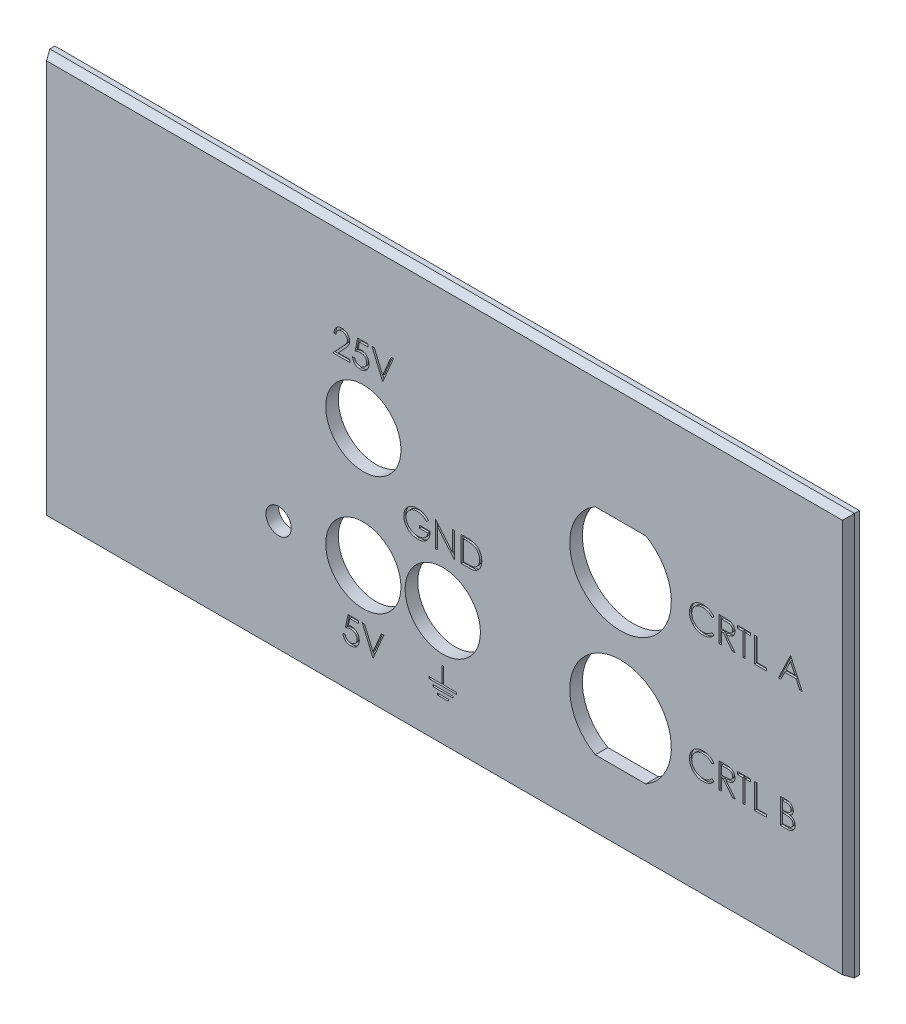
from build123d import *

# Parameters (mm, degrees)
SKETCH3_W               = 101.6
SKETCH3_H               = 50.8
BOSS_EXTRUDE1_DEPTH     = 0.635
SKETCH4_W               = 101.6
SKETCH4_H               = 50.8
BOSS_EXTRUDE2_DEPTH     = 0.9525
BOSS_EXTRUDE2_TAPER     = 30
CUT_EXTRUDE1_DEPTH      = 57.818308284
CUT_EXTRUDE1_DEPTH_BACK = 57.818308284
SKETCH5_R               = 4.750000025
M3_CLEARANCE_HOLE1_D    = 3.2
CUT_EXTRUDE2_DEPTH      = 57.818308284
CUT_EXTRUDE2_DEPTH_BACK = 0.254
SKETCH9_W               = 1.359861342
SKETCH9_H               = 0.220518055
SKETCH9_W_2             = 2.545442286
SKETCH9_H_2             = 0.219332475


with BuildPart() as part:
    # Sketch3 → Boss-Extrude1 (new body)
    with BuildSketch(Plane.XY.offset(-0.79375)):
        Rectangle(SKETCH3_W, SKETCH3_H)
    extrude(amount=BOSS_EXTRUDE1_DEPTH)

    # Sketch4 → Boss-Extrude2 (add)
    with BuildSketch(Plane.XY.offset(-0.15875)):
        Rectangle(SKETCH4_W, SKETCH4_H)
    extrude(amount=BOSS_EXTRUDE2_DEPTH, taper=BOSS_EXTRUDE2_TAPER)

    # Sketch5 → Cut-Extrude1 (cut, two sides: drawn at the far end of the back side and taken through both)
    with BuildSketch(Plane.XY.offset(0.79375).offset(-CUT_EXTRUDE1_DEPTH_BACK)):
        with Locations((-10.254, 4.6686)):
            Circle(SKETCH5_R)
        with Locations((-10.254, -10.3314)):
            Circle(SKETCH5_R)
        with Locations((-0.2214, -10.2764)):
            Circle(SKETCH5_R)
        with BuildLine():
            Line((19.032749463, 10.72709), (25.417250537, 10.72709))
            ThreePointArc((25.417250537, 10.72709), (22.225, -1.24901), (19.032749463, 10.72709))
        make_face()
        with BuildLine():
            Line((25.417250537, -16.39757), (19.032749463, -16.39757))
            ThreePointArc((19.032749463, -16.39757), (22.225, -4.42147), (25.417250537, -16.39757))
        make_face()
    extrude(amount=CUT_EXTRUDE1_DEPTH + CUT_EXTRUDE1_DEPTH_BACK, mode=Mode.SUBTRACT)

    # M3 Clearance Hole1 (through all)
    with Locations(Plane.XY.offset(0.79375)):
        with Locations((-20.955, -10.8314)):
            Hole(M3_CLEARANCE_HOLE1_D / 2)

    # Sketch9 → Cut-Extrude2 (cut, two sides: drawn at the far end of the back side and taken through both)
    # profile 1 of 21: a face of its own
    with BuildSketch(Plane.XY.offset(0.79375).offset(-CUT_EXTRUDE2_DEPTH_BACK)):
        with BuildLine():
            Line((34.021410066, -9.830062147), (33.772091156, -10.020867436))
            add(Edge.make_bspline(
                [(33.772091156, -10.020867436), (33.754305814, -9.999671163), (33.718974916, -9.95756439), (33.662134068, -9.898437232), (33.602896149, -9.843042316), (33.541283804, -9.791115754), (33.476188031, -9.744473402), (33.409185735, -9.700684616), (33.33915608, -9.661434596), (33.242317006, -9.613843173), (33.115636458, -9.56418059), (32.956165425, -9.522539801), (32.789694643, -9.49603202), (32.676122535, -9.493161057), (32.618355178, -9.491700769)],
                knots=[0, 0, 0, 0, 0.757959112, 1.505699292, 2.245454638, 2.979532153, 3.711538275, 4.438200793, 5.171680507, 5.909471876, 7.393775596, 8.890124382, 10.418191784, 12, 12, 12, 12], degree=3))
            add(Edge.make_bspline(
                [(32.618355178, -9.491700769), (32.586529614, -9.492067221), (32.523173856, -9.492796723), (32.429149884, -9.502420715), (32.336881616, -9.515947313), (32.246429072, -9.536018142), (32.157907388, -9.561393304), (32.070737852, -9.591714929), (31.986182522, -9.629229677), (31.903071692, -9.670693598), (31.823443407, -9.717527066), (31.748100614, -9.768611321), (31.6773181, -9.823374716), (31.611039874, -9.882022505), (31.549198178, -9.944290569), (31.492241117, -10.010842508), (31.440365781, -10.081465551), (31.392543908, -10.155228427), (31.349715214, -10.231916281), (31.313855966, -10.311812952), (31.28210132, -10.393550246), (31.25697415, -10.478051656), (31.237085481, -10.564722594), (31.223362529, -10.653795666), (31.213847987, -10.745084789), (31.213122113, -10.80696038), (31.21275622, -10.838150088)],
                knots=[0, 0, 0, 0, 1.054917814, 2.100044995, 3.131103042, 4.146048494, 5.169673617, 6.183595914, 7.203665975, 8.234915748, 9.262203917, 10.264457458, 11.251630812, 12.227803204, 13.197192746, 14.159520551, 15.12972552, 16.100847026, 17.073214652, 18.039054194, 19.002613845, 19.979014051, 20.95965708, 21.949030935, 22.966165397, 24, 24, 24, 24], degree=3))
            add(Edge.make_bspline(
                [(31.21275622, -10.838150088), (31.21390087, -10.885077785), (31.216148239, -10.977214095), (31.236149228, -11.112170291), (31.266543132, -11.241456903), (31.312095834, -11.364265759), (31.368265258, -11.482111199), (31.43924067, -11.592999301), (31.521442815, -11.698605756), (31.616034609, -11.796434716), (31.719817028, -11.885800738), (31.831166919, -11.964495909), (31.949806952, -12.030095838), (32.074427181, -12.084684018), (32.205986584, -12.126645478), (32.344248583, -12.15618579), (32.488912465, -12.175455482), (32.587763278, -12.177300328), (32.638071725, -12.178239231)],
                knots=[0, 0, 0, 0, 1.029171465, 2.020641659, 2.987623507, 3.938342917, 4.889210282, 5.84687017, 6.821220943, 7.821438502, 8.827599549, 9.822697543, 10.807740252, 11.797342354, 12.80366471, 13.83203677, 14.896651826, 16, 16, 16, 16], degree=3))
            add(Edge.make_bspline(
                [(32.638071725, -12.178239231), (32.693500593, -12.176707266), (32.802597864, -12.173691994), (32.96258886, -12.148147532), (33.115747018, -12.106729278), (33.262080579, -12.048764734), (33.401177008, -11.973412652), (33.533253979, -11.882065291), (33.658422975, -11.773853732), (33.733689781, -11.691228323), (33.772091156, -11.649072564)],
                knots=[0, 0, 0, 0, 1.028121516, 2.023589091, 2.998037872, 3.967518031, 4.937445131, 5.927275754, 6.942489185, 8, 8, 8, 8], degree=3))
            Line((33.772091156, -11.649072564), (34.021410066, -11.8379698))
            add(Edge.make_bspline(
                [(34.021410066, -11.8379698), (34.001345781, -11.863858252), (33.961313317, -11.915511154), (33.896490687, -11.988329062), (33.828203424, -12.056822008), (33.755944316, -12.120437779), (33.680544605, -12.18044933), (33.600650436, -12.235151706), (33.517312099, -12.285308436), (33.430811965, -12.331234289), (33.341241938, -12.371980649), (33.248709343, -12.40686371), (33.153613035, -12.436912717), (33.055948667, -12.461634117), (32.955513659, -12.480930028), (32.852670443, -12.493829305), (32.747197056, -12.502666613), (32.676039482, -12.503472079), (32.639979778, -12.503880256)],
                knots=[0, 0, 0, 0, 0.986787822, 1.968848986, 2.935600012, 3.899624008, 4.868462664, 5.837806735, 6.815139263, 7.798259679, 8.787526145, 9.778297419, 10.776456485, 11.791383307, 12.812564526, 13.85620153, 14.913611965, 16, 16, 16, 16], degree=3))
            add(Edge.make_bspline(
                [(32.639979778, -12.503880256), (32.605831594, -12.503642592), (32.538307789, -12.503172639), (32.438613922, -12.495559745), (32.341559088, -12.485173197), (32.247420677, -12.469533936), (32.155684971, -12.451078713), (32.067183584, -12.426339787), (31.981045643, -12.398627329), (31.89761722, -12.366056377), (31.816827349, -12.329302411), (31.738936606, -12.287762926), (31.663980814, -12.241787234), (31.591223039, -12.19238876), (31.521738088, -12.137980779), (31.454923819, -12.079318904), (31.390405573, -12.016600851), (31.350488851, -11.971375377), (31.330419481, -11.948636867)],
                knots=[0, 0, 0, 0, 1.114604814, 2.203992996, 3.262667896, 4.300477797, 5.318619304, 6.316056647, 7.298880507, 8.271930387, 9.238335007, 10.195173496, 11.151986948, 12.108099108, 13.064862484, 14.031167946, 15.010108607, 16, 16, 16, 16], degree=3))
            add(Edge.make_bspline(
                [(31.330419481, -11.948636867), (31.29827429, -11.909138788), (31.234371993, -11.830619487), (31.152615123, -11.703360061), (31.08263127, -11.570492472), (31.026047399, -11.431318679), (30.981812634, -11.286150978), (30.951168264, -11.13491619), (30.931255023, -10.977755556), (30.928977832, -10.870860755), (30.927820323, -10.816525489)],
                knots=[0, 0, 0, 0, 0.994628077, 1.977248131, 2.950237994, 3.925870899, 4.908910175, 5.911660606, 6.938484602, 8, 8, 8, 8], degree=3))
            add(Edge.make_bspline(
                [(30.927820323, -10.816525489), (30.929231105, -10.759415899), (30.932006732, -10.647056346), (30.955588632, -10.482161402), (30.993524255, -10.324181205), (31.047405718, -10.173410665), (31.115718429, -10.029056768), (31.200106858, -9.892222247), (31.299590622, -9.762032007), (31.413389487, -9.640461482), (31.538182713, -9.529300784), (31.671821923, -9.431505156), (31.814045546, -9.350118553), (31.96328674, -9.28208632), (32.120663037, -9.229794557), (32.285838665, -9.193188451), (32.458503252, -9.170403639), (32.576307023, -9.167523272), (32.636163672, -9.166059744)],
                knots=[0, 0, 0, 0, 1.032925535, 2.032216505, 3.007276963, 3.968222605, 4.92396291, 5.891752235, 6.871517503, 7.883894988, 8.900124299, 9.891468569, 10.874487609, 11.85992873, 12.854644235, 13.869047385, 14.917252991, 16, 16, 16, 16], degree=3))
            add(Edge.make_bspline(
                [(32.636163672, -9.166059744), (32.672643943, -9.166497112), (32.744852965, -9.167362838), (32.851671443, -9.175804838), (32.955668411, -9.189877896), (33.056915516, -9.209033187), (33.155905318, -9.232806972), (33.251881251, -9.2637771), (33.345406488, -9.29918881), (33.435891183, -9.339972561), (33.522901197, -9.385753105), (33.606409429, -9.436022993), (33.68575255, -9.490719902), (33.761488863, -9.54937864), (33.832351426, -9.61324019), (33.900352196, -9.680548009), (33.963181888, -9.753240835), (34.001965143, -9.804408168), (34.021410066, -9.830062147)],
                knots=[0, 0, 0, 0, 1.096760587, 2.17092713, 3.219439832, 4.250915756, 5.268269357, 6.278326846, 7.281116186, 8.274029601, 9.260640565, 10.235837813, 11.203064059, 12.156899882, 13.114053108, 14.069676657, 15.032185724, 16, 16, 16, 16], degree=3))
        make_face()
    # profile 2 of 21: a face of its own
    with BuildSketch(Plane.XY.offset(0.79375).offset(-CUT_EXTRUDE2_DEPTH_BACK)):
        with BuildLine():
            Line((34.672692117, -9.24747), (35.308073728, -9.24747))
            add(Edge.make_bspline(
                [(35.308073728, -9.24747), (35.350474609, -9.247611139), (35.431888997, -9.247882141), (35.548523321, -9.249393226), (35.654502187, -9.253724248), (35.749770184, -9.25745132), (35.834325564, -9.264247582), (35.908427607, -9.270743311), (35.971735018, -9.279246561), (36.01005804, -9.287143623), (36.027409666, -9.290719199)],
                knots=[0, 0, 0, 0, 1.410062039, 2.707475311, 3.878576406, 4.937260626, 5.877586885, 6.699081471, 7.410979367, 8, 8, 8, 8], degree=3))
            add(Edge.make_bspline(
                [(36.027409666, -9.290719199), (36.050638532, -9.296458479), (36.096600729, -9.307814604), (36.162776861, -9.331817242), (36.225836283, -9.359593616), (36.285517052, -9.392217848), (36.341520234, -9.429932112), (36.394423273, -9.472085338), (36.444466229, -9.518446874), (36.48962528, -9.570185623), (36.532205705, -9.624465886), (36.568118245, -9.683161437), (36.599075837, -9.744540108), (36.623723378, -9.809226123), (36.643569825, -9.876592159), (36.657563628, -9.947248424), (36.665955777, -10.020873023), (36.666810174, -10.071090555), (36.667243399, -10.096553534)],
                knots=[0, 0, 0, 0, 1.027469482, 2.033020251, 3.019912614, 3.986113645, 4.951240523, 5.91722682, 6.890402269, 7.87763091, 8.8651537, 9.85103654, 10.82876324, 11.815024772, 12.821070561, 13.842952187, 14.906261191, 16, 16, 16, 16], degree=3))
            add(Edge.make_bspline(
                [(36.667243399, -10.096553534), (36.665910808, -10.138858236), (36.663310578, -10.221405667), (36.639067091, -10.341203752), (36.599355534, -10.452954059), (36.544633693, -10.55651588), (36.474947454, -10.649870537), (36.39119568, -10.731867593), (36.293331646, -10.800483799), (36.20222791, -10.848065987), (36.121751457, -10.878539554), (36.055499809, -10.899981108), (35.983230479, -10.916547319), (35.905635897, -10.931388296), (35.822393153, -10.942593047), (35.73370176, -10.950799601), (35.639498465, -10.955928631), (35.574783738, -10.956692449), (35.541492198, -10.957085385)],
                knots=[0, 0, 0, 0, 1.260483769, 2.459530307, 3.627416485, 4.787058657, 5.939039949, 7.08810263, 8.267026773, 9.491475466, 10.141966685, 10.831826277, 11.566392101, 12.351337768, 13.187381173, 14.07005841, 15.007169909, 16, 16, 16, 16], degree=3))
            Line((35.541492198, -10.957085385), (36.707948528, -12.42247))
            Line((36.707948528, -12.42247), (36.355594762, -12.42247))
            Line((36.355594762, -12.42247), (35.189138432, -10.957085385))
            Line((35.189138432, -10.957085385), (34.957628015, -10.957085385))
            Line((34.957628015, -10.957085385), (34.957628015, -12.42247))
            Line((34.957628015, -12.42247), (34.672692117, -12.42247))
            Line((34.672692117, -12.42247), (34.672692117, -9.24747))
        make_face()
        with BuildLine():
            Line((34.957628015, -9.573111026), (34.957628015, -10.631444359))
            Line((34.957628015, -10.631444359), (35.538948127, -10.635896482))
            add(Edge.make_bspline(
                [(35.538948127, -10.635896482), (35.566089877, -10.63590849), (35.618698318, -10.635931764), (35.694808207, -10.632308838), (35.765674308, -10.6281874), (35.831025562, -10.62188335), (35.890891162, -10.613758914), (35.945241187, -10.603596207), (35.994164355, -10.591756121), (36.051222315, -10.573430361), (36.114936883, -10.54439633), (36.184180422, -10.502154771), (36.243146828, -10.449024212), (36.292965175, -10.38826972), (36.332996873, -10.321471123), (36.361219951, -10.249429131), (36.379129166, -10.173962467), (36.38124149, -10.122093755), (36.382307502, -10.095917516)],
                knots=[0, 0, 0, 0, 1.146690395, 2.22261258, 3.21895312, 4.145990853, 4.996080663, 5.770904154, 6.481378293, 7.121626537, 8.300444488, 9.431385265, 10.535395872, 11.636531494, 12.74115979, 13.810798291, 14.895190096, 16, 16, 16, 16], degree=3))
            add(Edge.make_bspline(
                [(36.382307502, -10.095917516), (36.381217006, -10.070384553), (36.379056042, -10.019787536), (36.361413231, -9.94571396), (36.331577863, -9.875803227), (36.291371262, -9.81033973), (36.242386314, -9.75091667), (36.184948013, -9.700073895), (36.120626871, -9.658119024), (36.060509427, -9.631308978), (36.006775534, -9.614871683), (35.960121486, -9.603304556), (35.907406074, -9.594011359), (35.848373336, -9.586565475), (35.783275285, -9.580165633), (35.711782766, -9.575855091), (35.634370116, -9.573302514), (35.580715399, -9.573176341), (35.552940515, -9.573111026)],
                knots=[0, 0, 0, 0, 1.101028733, 2.181837193, 3.264309656, 4.369019818, 5.486613113, 6.575447106, 7.666700264, 8.788928104, 9.402425223, 10.0903467, 10.862060571, 11.710948788, 12.657782767, 13.684531032, 14.801375019, 16, 16, 16, 16], degree=3))
            Line((35.552940515, -9.573111026), (34.957628015, -9.573111026))
        make_face(mode=Mode.SUBTRACT)
    # profile 3 of 21: a face of its own
    with BuildSketch(Plane.XY.offset(0.79375).offset(-CUT_EXTRUDE2_DEPTH_BACK)):
        Polygon((36.992884425, -9.573111026), (36.992884425, -9.24747), (38.661794682, -9.24747), (38.661794682, -9.573111026), (37.969807502, -9.573111026), (37.969807502, -12.42247), (37.684871605, -12.42247), (37.684871605, -9.573111026), align=None)
    # profile 4 of 21: a face of its own
    with BuildSketch(Plane.XY.offset(0.79375).offset(-CUT_EXTRUDE2_DEPTH_BACK)):
        Polygon((39.15025622, -9.24747), (39.435192117, -9.24747), (39.435192117, -12.096828974), (40.656345964, -12.096828974), (40.656345964, -12.42247), (39.15025622, -12.42247), align=None)
    # profile 5 of 21: a face of its own
    with BuildSketch(Plane.XY.offset(0.79375).offset(-CUT_EXTRUDE2_DEPTH_BACK)):
        with BuildLine():
            Line((42.406666476, -9.24747), (43.026147646, -9.24747))
            add(Edge.make_bspline(
                [(43.026147646, -9.24747), (43.056472051, -9.247629431), (43.115248296, -9.247938447), (43.20071879, -9.252731002), (43.280773068, -9.259265759), (43.355434347, -9.269634486), (43.424668127, -9.282145599), (43.488683055, -9.297296532), (43.547275568, -9.315463531), (43.617227836, -9.344352658), (43.696984436, -9.387281532), (43.783342978, -9.45071673), (43.857188252, -9.528306893), (43.920857269, -9.615830445), (43.971476856, -9.712110752), (44.008097575, -9.814853016), (44.031282219, -9.922732025), (44.033666585, -9.996794051), (44.034871605, -10.034223806)],
                knots=[0, 0, 0, 0, 1.001505555, 1.941167018, 2.826882275, 3.653841531, 4.429895133, 5.150066043, 5.825578002, 6.45369114, 7.647487171, 8.808567382, 9.977351308, 11.170798116, 12.373658725, 13.556498008, 14.765093433, 16, 16, 16, 16], degree=3))
            add(Edge.make_bspline(
                [(44.034871605, -10.034223806), (44.033879899, -10.069287196), (44.031931105, -10.138190063), (44.013295887, -10.238968291), (43.984121567, -10.334899754), (43.943567519, -10.425634346), (43.890860709, -10.509121981), (43.828396377, -10.586036144), (43.753033849, -10.653120317), (43.696570338, -10.690624236), (43.667889433, -10.709674527)],
                knots=[0, 0, 0, 0, 1.044552857, 2.05264487, 3.044412934, 4.028983338, 5.005914585, 5.980388656, 6.974128949, 8, 8, 8, 8], degree=3))
            add(Edge.make_bspline(
                [(43.667889433, -10.709674527), (43.703957821, -10.723522062), (43.772965582, -10.750015826), (43.86793075, -10.796856569), (43.94975036, -10.847803626), (44.019053485, -10.903440376), (44.078324072, -10.963410511), (44.13007924, -11.028593365), (44.174240201, -11.099839238), (44.212079782, -11.176405302), (44.241606153, -11.257509741), (44.263718581, -11.342391803), (44.276389053, -11.430747113), (44.278192127, -11.490877422), (44.279102374, -11.521233021)],
                knots=[0, 0, 0, 0, 1.27268992, 2.434971085, 3.483601985, 4.442670788, 5.356604649, 6.2567628, 7.179492994, 8.113709626, 9.066344395, 10.018646069, 10.999752585, 12, 12, 12, 12], degree=3))
            add(Edge.make_bspline(
                [(44.279102374, -11.521233021), (44.278216235, -11.552227255), (44.276472732, -11.613209279), (44.263609472, -11.702794293), (44.241829782, -11.788405852), (44.211829528, -11.870597696), (44.172675142, -11.949210818), (44.125024775, -12.024334279), (44.068208999, -12.095213279), (44.004651968, -12.162635423), (43.932749879, -12.223257773), (43.855174873, -12.277247021), (43.770949997, -12.321648092), (43.681458545, -12.358946197), (43.58569663, -12.387437013), (43.484094264, -12.407369276), (43.376739076, -12.42079956), (43.303070231, -12.421903739), (43.265290274, -12.42247)],
                knots=[0, 0, 0, 0, 0.978564426, 1.925352924, 2.850884081, 3.763762016, 4.682927383, 5.618979971, 6.567305752, 7.547517671, 8.540179244, 9.531824382, 10.526200242, 11.540722885, 12.589160233, 13.674978461, 14.80764778, 16, 16, 16, 16], degree=3))
            Line((43.265290274, -12.42247), (42.406666476, -12.42247))
            Line((42.406666476, -12.42247), (42.406666476, -9.24747))
        make_face()
        with BuildLine():
            Line((42.691602374, -9.573111026), (42.691602374, -10.590739231))
            Line((42.691602374, -10.590739231), (42.88304368, -10.590739231))
            add(Edge.make_bspline(
                [(42.88304368, -10.590739231), (42.911027944, -10.590376443), (42.965099246, -10.589675464), (43.043403723, -10.587667488), (43.116088561, -10.582044977), (43.183028296, -10.576424083), (43.244117513, -10.567284992), (43.299220873, -10.556406424), (43.349203171, -10.544901217), (43.406842616, -10.525334611), (43.472223077, -10.496417006), (43.541921678, -10.451538983), (43.603366519, -10.398086177), (43.655252539, -10.336408661), (43.69771723, -10.268494336), (43.727211815, -10.195426808), (43.747211851, -10.119027117), (43.749018454, -10.066577702), (43.749935707, -10.039947965)],
                knots=[0, 0, 0, 0, 1.156816544, 2.235205308, 3.236616184, 4.169592532, 5.011045266, 5.787822928, 6.49130361, 7.128639758, 8.301311294, 9.436451833, 10.541879658, 11.654887649, 12.756523258, 13.837046038, 14.901820046, 16, 16, 16, 16], degree=3))
            add(Edge.make_bspline(
                [(43.749935707, -10.039947965), (43.749458387, -10.022326015), (43.74852207, -9.987758636), (43.740853717, -9.937367436), (43.727820275, -9.889974889), (43.711079594, -9.844931518), (43.687685569, -9.803645768), (43.660141571, -9.764690155), (43.626862409, -9.729391304), (43.588982561, -9.696398974), (43.545431881, -9.667148581), (43.496236352, -9.641530174), (43.440730388, -9.620901041), (43.379849441, -9.602834245), (43.312656383, -9.590144864), (43.23992661, -9.579573577), (43.1610644, -9.574191733), (43.1065042, -9.573479296), (43.078301092, -9.573111026)],
                knots=[0, 0, 0, 0, 0.91205012, 1.789085906, 2.630437955, 3.453916878, 4.269457761, 5.079663411, 5.91843418, 6.774407191, 7.675494373, 8.627863946, 9.638891023, 10.736472738, 11.911756761, 13.175263542, 14.539845004, 16, 16, 16, 16], degree=3))
            Line((43.078301092, -9.573111026), (42.691602374, -9.573111026))
        make_face(mode=Mode.SUBTRACT)
        with BuildLine():
            Line((42.691602374, -10.916380256), (42.691602374, -12.096828974))
            Line((42.691602374, -12.096828974), (43.097381621, -12.096828974))
            add(Edge.make_bspline(
                [(43.097381621, -12.096828974), (43.126427361, -12.096480861), (43.182409195, -12.095809917), (43.26323674, -12.093619571), (43.338151412, -12.088637293), (43.406811364, -12.080794272), (43.469957989, -12.072286679), (43.526833762, -12.060846445), (43.577899731, -12.047739174), (43.637112853, -12.027478889), (43.703791035, -11.996004234), (43.775646598, -11.948547757), (43.839533239, -11.892011613), (43.893785152, -11.82657857), (43.938246935, -11.755430152), (43.970591526, -11.680005441), (43.990540375, -11.601550713), (43.992955343, -11.548059481), (43.994166476, -11.521233021)],
                knots=[0, 0, 0, 0, 1.160039823, 2.235823828, 3.228722157, 4.157150951, 4.99529583, 5.772374946, 6.472645482, 7.099169577, 8.269452708, 9.405989375, 10.527446681, 11.663510218, 12.788923519, 13.866172445, 14.929861265, 16, 16, 16, 16], degree=3))
            add(Edge.make_bspline(
                [(43.994166476, -11.521233021), (43.99391601, -11.504456919), (43.993419118, -11.471175316), (43.98592556, -11.422265965), (43.975027264, -11.374889637), (43.960938035, -11.328917687), (43.940418947, -11.285181267), (43.916464438, -11.242815374), (43.888378024, -11.201764003), (43.844613673, -11.149864316), (43.780957659, -11.090068169), (43.69050937, -11.031523435), (43.587664499, -10.984308638), (43.513072417, -10.964261256), (43.474540074, -10.953905296)],
                knots=[0, 0, 0, 0, 0.723448775, 1.435228256, 2.130040452, 2.821711965, 3.505591119, 4.210454504, 4.921174351, 5.648778258, 7.137944449, 8.670945889, 10.280296675, 12, 12, 12, 12], degree=3))
            add(Edge.make_bspline(
                [(43.474540074, -10.953905296), (43.459092251, -10.950771042), (43.425598186, -10.943975331), (43.370981309, -10.936801914), (43.308628057, -10.930411039), (43.238394446, -10.925683774), (43.160191619, -10.92079741), (43.073852557, -10.918897108), (42.97972985, -10.916629922), (42.914422484, -10.916465607), (42.880499609, -10.916380256)],
                knots=[0, 0, 0, 0, 0.634451884, 1.375622551, 2.216452059, 3.157844607, 4.20941857, 5.370758133, 6.634282058, 8, 8, 8, 8], degree=3))
            Line((42.880499609, -10.916380256), (42.691602374, -10.916380256))
        make_face(mode=Mode.SUBTRACT)
    # profile 6 of 21: a face of its own
    with BuildSketch(Plane.XY.offset(0.79375).offset(-CUT_EXTRUDE2_DEPTH_BACK)):
        with BuildLine():
            Line((34.021410066, 6.169397853), (33.772091156, 5.978592564))
            add(Edge.make_bspline(
                [(33.772091156, 5.978592564), (33.754305814, 5.999788837), (33.718974916, 6.04189561), (33.662134068, 6.101022768), (33.602896149, 6.156417684), (33.541283804, 6.208344246), (33.476188031, 6.254986598), (33.409185735, 6.298775384), (33.33915608, 6.338025404), (33.242317006, 6.385616827), (33.115636458, 6.43527941), (32.956165425, 6.476920199), (32.789694643, 6.50342798), (32.676122535, 6.506298943), (32.618355178, 6.507759231)],
                knots=[0, 0, 0, 0, 0.757959112, 1.505699292, 2.245454638, 2.979532153, 3.711538275, 4.438200793, 5.171680507, 5.909471876, 7.393775596, 8.890124382, 10.418191784, 12, 12, 12, 12], degree=3))
            add(Edge.make_bspline(
                [(32.618355178, 6.507759231), (32.586529614, 6.507392779), (32.523173856, 6.506663277), (32.429149884, 6.497039285), (32.336881616, 6.483512687), (32.246429072, 6.463441858), (32.157907388, 6.438066696), (32.070737852, 6.407745071), (31.986182522, 6.370230323), (31.903071692, 6.328766402), (31.823443407, 6.281932934), (31.748100614, 6.230848679), (31.6773181, 6.176085284), (31.611039874, 6.117437495), (31.549198178, 6.055169431), (31.492241117, 5.988617492), (31.440365781, 5.917994449), (31.392543908, 5.844231573), (31.349715214, 5.767543719), (31.313855966, 5.687647048), (31.28210132, 5.605909754), (31.25697415, 5.521408344), (31.237085481, 5.434737406), (31.223362529, 5.345664334), (31.213847987, 5.254375211), (31.213122113, 5.19249962), (31.21275622, 5.161309912)],
                knots=[0, 0, 0, 0, 1.054917814, 2.100044995, 3.131103042, 4.146048494, 5.169673617, 6.183595914, 7.203665975, 8.234915748, 9.262203917, 10.264457458, 11.251630812, 12.227803204, 13.197192746, 14.159520551, 15.12972552, 16.100847026, 17.073214652, 18.039054194, 19.002613845, 19.979014051, 20.95965708, 21.949030935, 22.966165397, 24, 24, 24, 24], degree=3))
            add(Edge.make_bspline(
                [(31.21275622, 5.161309912), (31.21390087, 5.114382215), (31.216148239, 5.022245905), (31.236149228, 4.887289709), (31.266543132, 4.758003097), (31.312095834, 4.635194241), (31.368265258, 4.517348801), (31.43924067, 4.406460699), (31.521442815, 4.300854244), (31.616034609, 4.203025284), (31.719817028, 4.113659262), (31.831166919, 4.034964091), (31.949806952, 3.969364162), (32.074427181, 3.914775982), (32.205986584, 3.872814522), (32.344248583, 3.84327421), (32.488912465, 3.824004518), (32.587763278, 3.822159672), (32.638071725, 3.821220769)],
                knots=[0, 0, 0, 0, 1.029171465, 2.020641659, 2.987623507, 3.938342917, 4.889210282, 5.84687017, 6.821220943, 7.821438502, 8.827599549, 9.822697543, 10.807740252, 11.797342354, 12.80366471, 13.83203677, 14.896651826, 16, 16, 16, 16], degree=3))
            add(Edge.make_bspline(
                [(32.638071725, 3.821220769), (32.693500593, 3.822752734), (32.802597864, 3.825768006), (32.96258886, 3.851312468), (33.115747018, 3.892730722), (33.262080579, 3.950695266), (33.401177008, 4.026047348), (33.533253979, 4.117394709), (33.658422975, 4.225606268), (33.733689781, 4.308231677), (33.772091156, 4.350387436)],
                knots=[0, 0, 0, 0, 1.028121516, 2.023589091, 2.998037872, 3.967518031, 4.937445131, 5.927275754, 6.942489185, 8, 8, 8, 8], degree=3))
            Line((33.772091156, 4.350387436), (34.021410066, 4.1614902))
            add(Edge.make_bspline(
                [(34.021410066, 4.1614902), (34.001345781, 4.135601748), (33.961313317, 4.083948846), (33.896490687, 4.011130938), (33.828203424, 3.942637992), (33.755944316, 3.879022221), (33.680544605, 3.81901067), (33.600650436, 3.764308294), (33.517312099, 3.714151564), (33.430811965, 3.668225711), (33.341241938, 3.627479351), (33.248709343, 3.59259629), (33.153613035, 3.562547283), (33.055948667, 3.537825883), (32.955513659, 3.518529972), (32.852670443, 3.505630695), (32.747197056, 3.496793387), (32.676039482, 3.495987921), (32.639979778, 3.495579744)],
                knots=[0, 0, 0, 0, 0.986787822, 1.968848986, 2.935600012, 3.899624008, 4.868462664, 5.837806735, 6.815139263, 7.798259679, 8.787526145, 9.778297419, 10.776456485, 11.791383307, 12.812564526, 13.85620153, 14.913611965, 16, 16, 16, 16], degree=3))
            add(Edge.make_bspline(
                [(32.639979778, 3.495579744), (32.605831594, 3.495817408), (32.538307789, 3.496287361), (32.438613922, 3.503900255), (32.341559088, 3.514286803), (32.247420677, 3.529926064), (32.155684971, 3.548381287), (32.067183584, 3.573120213), (31.981045643, 3.600832671), (31.89761722, 3.633403623), (31.816827349, 3.670157589), (31.738936606, 3.711697074), (31.663980814, 3.757672766), (31.591223039, 3.80707124), (31.521738088, 3.861479221), (31.454923819, 3.920141096), (31.390405573, 3.982859149), (31.350488851, 4.028084623), (31.330419481, 4.050823133)],
                knots=[0, 0, 0, 0, 1.114604814, 2.203992996, 3.262667896, 4.300477797, 5.318619304, 6.316056647, 7.298880507, 8.271930387, 9.238335007, 10.195173496, 11.151986948, 12.108099108, 13.064862484, 14.031167946, 15.010108607, 16, 16, 16, 16], degree=3))
            add(Edge.make_bspline(
                [(31.330419481, 4.050823133), (31.29827429, 4.090321212), (31.234371993, 4.168840513), (31.152615123, 4.296099939), (31.08263127, 4.428967528), (31.026047399, 4.568141321), (30.981812634, 4.713309022), (30.951168264, 4.86454381), (30.931255023, 5.021704444), (30.928977832, 5.128599245), (30.927820323, 5.182934511)],
                knots=[0, 0, 0, 0, 0.994628077, 1.977248131, 2.950237994, 3.925870899, 4.908910175, 5.911660606, 6.938484602, 8, 8, 8, 8], degree=3))
            add(Edge.make_bspline(
                [(30.927820323, 5.182934511), (30.929231105, 5.240044101), (30.932006732, 5.352403654), (30.955588632, 5.517298598), (30.993524255, 5.675278795), (31.047405718, 5.826049335), (31.115718429, 5.970403232), (31.200106858, 6.107237753), (31.299590622, 6.237427993), (31.413389487, 6.358998518), (31.538182713, 6.470159216), (31.671821923, 6.567954844), (31.814045546, 6.649341447), (31.96328674, 6.71737368), (32.120663037, 6.769665443), (32.285838665, 6.806271549), (32.458503252, 6.829056361), (32.576307023, 6.831936728), (32.636163672, 6.833400256)],
                knots=[0, 0, 0, 0, 1.032925535, 2.032216505, 3.007276963, 3.968222605, 4.92396291, 5.891752235, 6.871517503, 7.883894988, 8.900124299, 9.891468569, 10.874487609, 11.85992873, 12.854644235, 13.869047385, 14.917252991, 16, 16, 16, 16], degree=3))
            add(Edge.make_bspline(
                [(32.636163672, 6.833400256), (32.672643943, 6.832962888), (32.744852965, 6.832097162), (32.851671443, 6.823655162), (32.955668411, 6.809582104), (33.056915516, 6.790426813), (33.155905318, 6.766653028), (33.251881251, 6.7356829), (33.345406488, 6.70027119), (33.435891183, 6.659487439), (33.522901197, 6.613706895), (33.606409429, 6.563437007), (33.68575255, 6.508740098), (33.761488863, 6.45008136), (33.832351426, 6.38621981), (33.900352196, 6.318911991), (33.963181888, 6.246219165), (34.001965143, 6.195051832), (34.021410066, 6.169397853)],
                knots=[0, 0, 0, 0, 1.096760587, 2.17092713, 3.219439832, 4.250915756, 5.268269357, 6.278326846, 7.281116186, 8.274029601, 9.260640565, 10.235837813, 11.203064059, 12.156899882, 13.114053108, 14.069676657, 15.032185724, 16, 16, 16, 16], degree=3))
        make_face()
    # profile 7 of 21: a face of its own
    with BuildSketch(Plane.XY.offset(0.79375).offset(-CUT_EXTRUDE2_DEPTH_BACK)):
        with BuildLine():
            Line((34.672692117, 6.75199), (35.308073728, 6.75199))
            add(Edge.make_bspline(
                [(35.308073728, 6.75199), (35.350474609, 6.751848861), (35.431888997, 6.751577859), (35.548523321, 6.750066774), (35.654502187, 6.745735752), (35.749770184, 6.74200868), (35.834325564, 6.735212418), (35.908427607, 6.728716689), (35.971735018, 6.720213439), (36.01005804, 6.712316377), (36.027409666, 6.708740801)],
                knots=[0, 0, 0, 0, 1.410062039, 2.707475311, 3.878576406, 4.937260626, 5.877586885, 6.699081471, 7.410979367, 8, 8, 8, 8], degree=3))
            add(Edge.make_bspline(
                [(36.027409666, 6.708740801), (36.050638532, 6.703001521), (36.096600729, 6.691645396), (36.162776861, 6.667642758), (36.225836283, 6.639866384), (36.285517052, 6.607242152), (36.341520234, 6.569527888), (36.394423273, 6.527374662), (36.444466229, 6.481013126), (36.48962528, 6.429274377), (36.532205705, 6.374994114), (36.568118245, 6.316298563), (36.599075837, 6.254919892), (36.623723378, 6.190233877), (36.643569825, 6.122867841), (36.657563628, 6.052211576), (36.665955777, 5.978586977), (36.666810174, 5.928369445), (36.667243399, 5.902906466)],
                knots=[0, 0, 0, 0, 1.027469482, 2.033020251, 3.019912614, 3.986113645, 4.951240523, 5.91722682, 6.890402269, 7.87763091, 8.8651537, 9.85103654, 10.82876324, 11.815024772, 12.821070561, 13.842952187, 14.906261191, 16, 16, 16, 16], degree=3))
            add(Edge.make_bspline(
                [(36.667243399, 5.902906466), (36.665910808, 5.860601764), (36.663310578, 5.778054333), (36.639067091, 5.658256248), (36.599355534, 5.546505941), (36.544633693, 5.44294412), (36.474947454, 5.349589463), (36.39119568, 5.267592407), (36.293331646, 5.198976201), (36.20222791, 5.151394013), (36.121751457, 5.120920446), (36.055499809, 5.099478892), (35.983230479, 5.082912681), (35.905635897, 5.068071704), (35.822393153, 5.056866953), (35.73370176, 5.048660399), (35.639498465, 5.043531369), (35.574783738, 5.042767551), (35.541492198, 5.042374615)],
                knots=[0, 0, 0, 0, 1.260483769, 2.459530307, 3.627416485, 4.787058657, 5.939039949, 7.08810263, 8.267026773, 9.491475466, 10.141966685, 10.831826277, 11.566392101, 12.351337768, 13.187381173, 14.07005841, 15.007169909, 16, 16, 16, 16], degree=3))
            Line((35.541492198, 5.042374615), (36.707948528, 3.57699))
            Line((36.707948528, 3.57699), (36.355594762, 3.57699))
            Line((36.355594762, 3.57699), (35.189138432, 5.042374615))
            Line((35.189138432, 5.042374615), (34.957628015, 5.042374615))
            Line((34.957628015, 5.042374615), (34.957628015, 3.57699))
            Line((34.957628015, 3.57699), (34.672692117, 3.57699))
            Line((34.672692117, 3.57699), (34.672692117, 6.75199))
        make_face()
        with BuildLine():
            Line((34.957628015, 6.426348974), (34.957628015, 5.368015641))
            Line((34.957628015, 5.368015641), (35.538948127, 5.363563518))
            add(Edge.make_bspline(
                [(35.538948127, 5.363563518), (35.566089877, 5.36355151), (35.618698318, 5.363528236), (35.694808207, 5.367151162), (35.765674308, 5.3712726), (35.831025562, 5.37757665), (35.890891162, 5.385701086), (35.945241187, 5.395863793), (35.994164355, 5.407703879), (36.051222315, 5.426029639), (36.114936883, 5.45506367), (36.184180422, 5.497305229), (36.243146828, 5.550435788), (36.292965175, 5.61119028), (36.332996873, 5.677988877), (36.361219951, 5.750030869), (36.379129166, 5.825497533), (36.38124149, 5.877366245), (36.382307502, 5.903542484)],
                knots=[0, 0, 0, 0, 1.146690395, 2.22261258, 3.21895312, 4.145990853, 4.996080663, 5.770904154, 6.481378293, 7.121626537, 8.300444488, 9.431385265, 10.535395872, 11.636531494, 12.74115979, 13.810798291, 14.895190096, 16, 16, 16, 16], degree=3))
            add(Edge.make_bspline(
                [(36.382307502, 5.903542484), (36.381217006, 5.929075447), (36.379056042, 5.979672464), (36.361413231, 6.05374604), (36.331577863, 6.123656773), (36.291371262, 6.18912027), (36.242386314, 6.24854333), (36.184948013, 6.299386105), (36.120626871, 6.341340976), (36.060509427, 6.368151022), (36.006775534, 6.384588317), (35.960121486, 6.396155444), (35.907406074, 6.405448641), (35.848373336, 6.412894525), (35.783275285, 6.419294367), (35.711782766, 6.423604909), (35.634370116, 6.426157486), (35.580715399, 6.426283659), (35.552940515, 6.426348974)],
                knots=[0, 0, 0, 0, 1.101028733, 2.181837193, 3.264309656, 4.369019818, 5.486613113, 6.575447106, 7.666700264, 8.788928104, 9.402425223, 10.0903467, 10.862060571, 11.710948788, 12.657782767, 13.684531032, 14.801375019, 16, 16, 16, 16], degree=3))
            Line((35.552940515, 6.426348974), (34.957628015, 6.426348974))
        make_face(mode=Mode.SUBTRACT)
    # profile 8 of 21: a face of its own
    with BuildSketch(Plane.XY.offset(0.79375).offset(-CUT_EXTRUDE2_DEPTH_BACK)):
        Polygon((36.992884425, 6.426348974), (36.992884425, 6.75199), (38.661794682, 6.75199), (38.661794682, 6.426348974), (37.969807502, 6.426348974), (37.969807502, 3.57699), (37.684871605, 3.57699), (37.684871605, 6.426348974), align=None)
    # profile 9 of 21: a face of its own
    with BuildSketch(Plane.XY.offset(0.79375).offset(-CUT_EXTRUDE2_DEPTH_BACK)):
        Polygon((39.15025622, 6.75199), (39.435192117, 6.75199), (39.435192117, 3.902631026), (40.656345964, 3.902631026), (40.656345964, 3.57699), (39.15025622, 3.57699), align=None)
    # profile 10 of 21: a face of its own
    with BuildSketch(Plane.XY.offset(0.79375).offset(-CUT_EXTRUDE2_DEPTH_BACK)):
        Polygon((43.709230579, 6.75199), (45.174615194, 3.57699), (44.864874609, 3.57699), (44.3954936, 4.594618205), (42.956185707, 4.594618205), (42.473448327, 3.57699), (42.162435707, 3.57699), (43.668525451, 6.75199), align=None)
        Polygon((43.685697927, 6.133144848), (43.110737991, 4.920259231), (44.24539344, 4.920259231), align=None, mode=Mode.SUBTRACT)
    # profile 11 of 21: a face of its own
    with BuildSketch(Plane.XY.offset(0.79375).offset(-CUT_EXTRUDE2_DEPTH_BACK)):
        with BuildLine():
            Line((-10.884929487, -16.668900025), (-10.884929487, -16.994541051))
            Line((-10.884929487, -16.994541051), (-11.96488742, -16.994541051))
            Line((-11.96488742, -16.994541051), (-12.135976162, -17.829632196))
            add(Edge.make_bspline(
                [(-12.135976162, -17.829632196), (-12.10236119, -17.820351878), (-12.037237499, -17.80237273), (-11.941116768, -17.782410353), (-11.849865269, -17.7703767), (-11.790651183, -17.768733582), (-11.761997796, -17.767938487)],
                knots=[0, 0, 0, 0, 1.100273476, 2.13160584, 3.095893838, 4, 4, 4, 4], degree=3))
            add(Edge.make_bspline(
                [(-11.761997796, -17.767938487), (-11.726543261, -17.768705871), (-11.656830786, -17.770214741), (-11.554832599, -17.78470349), (-11.457466331, -17.807508984), (-11.36493561, -17.839368314), (-11.277069253, -17.880107858), (-11.19467568, -17.930998518), (-11.116518144, -17.990446611), (-11.043998791, -18.058795301), (-10.978208883, -18.134017053), (-10.920364021, -18.214895979), (-10.871230814, -18.300646073), (-10.831714986, -18.392086625), (-10.800160626, -18.488206714), (-10.779158459, -18.5900177), (-10.765173302, -18.696559923), (-10.763610851, -18.76940764), (-10.762814103, -18.806555273)],
                knots=[0, 0, 0, 0, 1.052922333, 2.070308379, 3.05430497, 4.020497103, 4.973039431, 5.925935799, 6.892292201, 7.88610001, 8.88166317, 9.857072816, 10.836096531, 11.812156883, 12.81219415, 13.836441305, 14.89672472, 16, 16, 16, 16], degree=3))
            add(Edge.make_bspline(
                [(-10.762814103, -18.806555273), (-10.763417421, -18.832429002), (-10.764615904, -18.883826798), (-10.770710623, -18.960157608), (-10.782445165, -19.034872464), (-10.798200172, -19.107981277), (-10.818649366, -19.179345636), (-10.843404436, -19.249169807), (-10.873699404, -19.317019201), (-10.906929294, -19.383535809), (-10.944345742, -19.447215883), (-10.985873388, -19.506768893), (-11.029747798, -19.563088205), (-11.076956769, -19.615569806), (-11.1279391, -19.663868829), (-11.182077356, -19.708271913), (-11.238939537, -19.749529977), (-11.299405364, -19.785968268), (-11.362127473, -19.81949895), (-11.428011642, -19.84700673), (-11.495558134, -19.871599852), (-11.565739129, -19.891202781), (-11.638395659, -19.906563027), (-11.713647491, -19.916995714), (-11.791099956, -19.92459434), (-11.84360086, -19.925070007), (-11.870120793, -19.925310281)],
                knots=[0, 0, 0, 0, 1.056347294, 2.098418968, 3.122841568, 4.141288669, 5.149314143, 6.15115421, 7.162517403, 8.180376062, 9.185164535, 10.17417709, 11.141909838, 12.097768115, 13.052685741, 14.0056014, 14.954263652, 15.917497458, 16.885230207, 17.854509472, 18.828990115, 19.81800267, 20.826176721, 21.857883937, 22.917946725, 24, 24, 24, 24], degree=3))
            add(Edge.make_bspline(
                [(-11.870120793, -19.925310281), (-11.901756657, -19.924683593), (-11.963996482, -19.923450657), (-12.055182997, -19.910552459), (-12.14291696, -19.892079478), (-12.226492124, -19.864288005), (-12.306657484, -19.829465244), (-12.382333807, -19.785454146), (-12.455454761, -19.735580245), (-12.523047823, -19.676724496), (-12.585782297, -19.612393842), (-12.641940344, -19.542582267), (-12.691954375, -19.468441987), (-12.735023474, -19.389612948), (-12.771760964, -19.30630228), (-12.800621704, -19.218197844), (-12.82391564, -19.125759983), (-12.833770314, -19.062120727), (-12.838775641, -19.029797461)],
                knots=[0, 0, 0, 0, 1.0467383, 2.05933395, 3.04377827, 4.011590433, 4.970194871, 5.932262533, 6.905835911, 7.896367577, 8.894135286, 9.877477877, 10.858688626, 11.851381753, 12.8477658, 13.868841284, 14.917554742, 16, 16, 16, 16], degree=3))
            Line((-12.838775641, -19.029797461), (-12.553839744, -19.029797461))
            add(Edge.make_bspline(
                [(-12.553839744, -19.029797461), (-12.546828838, -19.060074671), (-12.533353488, -19.118269151), (-12.503775416, -19.200031153), (-12.467611372, -19.272892164), (-12.424608856, -19.337816), (-12.373309899, -19.394429876), (-12.314772489, -19.444882496), (-12.249142769, -19.490398507), (-12.176214625, -19.528337731), (-12.099277046, -19.560694386), (-12.018752505, -19.582240566), (-11.936833562, -19.597390662), (-11.881426755, -19.598907188), (-11.853584335, -19.599669256)],
                knots=[0, 0, 0, 0, 1.136247022, 2.183929868, 3.172523383, 4.106158343, 5.02341133, 5.958108904, 6.928429099, 7.938127109, 8.96079061, 9.975095812, 10.982467395, 12, 12, 12, 12], degree=3))
            add(Edge.make_bspline(
                [(-11.853584335, -19.599669256), (-11.826407746, -19.598924693), (-11.77289682, -19.597458643), (-11.694146491, -19.586174682), (-11.618116241, -19.568796028), (-11.545556281, -19.542788374), (-11.475196885, -19.511179236), (-11.408817822, -19.470616275), (-11.344498783, -19.423934686), (-11.284238976, -19.370452601), (-11.229048904, -19.311515806), (-11.180284423, -19.248489885), (-11.139665366, -19.181255317), (-11.105435139, -19.1109761), (-11.079442503, -19.03688198), (-11.060899613, -18.9593202), (-11.050011124, -18.878099182), (-11.048513268, -18.822700594), (-11.04775, -18.794470938)],
                knots=[0, 0, 0, 0, 1.027316725, 2.022795036, 3.002884548, 3.971462791, 4.93288096, 5.914575861, 6.907176829, 7.935150275, 8.956128384, 9.956726525, 10.942570165, 11.921478529, 12.907843606, 13.90538589, 14.932640048, 16, 16, 16, 16], degree=3))
            add(Edge.make_bspline(
                [(-11.04775, -18.794470938), (-11.048347335, -18.769002221), (-11.049516533, -18.71915083), (-11.059069265, -18.646217264), (-11.075685375, -18.577208147), (-11.098748466, -18.511790235), (-11.128030591, -18.449901827), (-11.163814032, -18.391479051), (-11.206770328, -18.337291931), (-11.255839399, -18.287315114), (-11.309594907, -18.241191549), (-11.368961731, -18.201872271), (-11.432697522, -18.168794288), (-11.500034373, -18.140248318), (-11.572573959, -18.119746213), (-11.648879762, -18.104353917), (-11.729775775, -18.095449981), (-11.785084899, -18.094214554), (-11.813515224, -18.093579512)],
                knots=[0, 0, 0, 0, 1.045622112, 2.046656509, 3.013763289, 3.955457236, 4.890082067, 5.820317437, 6.762574623, 7.722996705, 8.69280354, 9.665887285, 10.63943826, 11.638615906, 12.663482002, 13.728887084, 14.832589034, 16, 16, 16, 16], degree=3))
            add(Edge.make_bspline(
                [(-11.813515224, -18.093579512), (-11.838125038, -18.094106191), (-11.888938061, -18.09519365), (-11.966882339, -18.103200544), (-12.048789831, -18.116117618), (-12.134346552, -18.133885142), (-12.223809441, -18.157136191), (-12.316989705, -18.18499863), (-12.414083261, -18.218310729), (-12.479504339, -18.243467809), (-12.513134615, -18.256400025)],
                knots=[0, 0, 0, 0, 0.817624296, 1.688186739, 2.600797293, 3.572016777, 4.590301741, 5.671205678, 6.80286297, 8, 8, 8, 8], degree=3))
            Line((-12.513134615, -18.256400025), (-12.18749359, -16.668900025))
            Line((-12.18749359, -16.668900025), (-10.884929487, -16.668900025))
        make_face()
    # profile 12 of 21: a face of its own
    with BuildSketch(Plane.XY.offset(0.79375).offset(-CUT_EXTRUDE2_DEPTH_BACK)):
        Polygon((-10.396467949, -16.668900025), (-10.091179487, -16.668900025), (-9.032846154, -19.170993374), (-7.974512821, -16.668900025), (-7.669224359, -16.668900025), (-9.01249359, -19.843900025), (-9.053198718, -19.843900025), align=None)
    # profile 13 of 21: a face of its own
    with BuildSketch(Plane.XY.offset(0.79375).offset(-CUT_EXTRUDE2_DEPTH_BACK)):
        with BuildLine():
            Line((-13.693583333, 13.204176948), (-13.978519231, 13.204176948))
            add(Edge.make_bspline(
                [(-13.978519231, 13.204176948), (-13.976662171, 13.241978396), (-13.973014954, 13.316219434), (-13.955935006, 13.424463264), (-13.931495781, 13.52792726), (-13.896941391, 13.625780682), (-13.854027839, 13.718888743), (-13.8025656, 13.806881614), (-13.741611178, 13.889423621), (-13.672480784, 13.965749572), (-13.597397804, 14.035769725), (-13.516384559, 14.096235553), (-13.431253713, 14.147323726), (-13.342263544, 14.190033138), (-13.248410032, 14.222091427), (-13.150544869, 14.2458782), (-13.048238081, 14.260189599), (-12.978533203, 14.261727919), (-12.943082532, 14.262510281)],
                knots=[0, 0, 0, 0, 1.10065271, 2.161652631, 3.183658789, 4.190468796, 5.17591951, 6.163126047, 7.15150782, 8.156236427, 9.156009102, 10.134482811, 11.092018607, 12.041330605, 13.001268258, 13.972401359, 14.968799086, 16, 16, 16, 16], degree=3))
            add(Edge.make_bspline(
                [(-12.943082532, 14.262510281), (-12.908268136, 14.261695253), (-12.839859092, 14.260093751), (-12.740017122, 14.246340532), (-12.644969148, 14.224799888), (-12.554900959, 14.194578046), (-12.470531172, 14.153952173), (-12.391225982, 14.10515012), (-12.316041246, 14.048707844), (-12.248362236, 13.982256171), (-12.186215621, 13.911315436), (-12.132601432, 13.835579981), (-12.086688063, 13.7573577), (-12.04841781, 13.676052117), (-12.020245455, 13.590897684), (-11.998856652, 13.50313415), (-11.986766784, 13.411853072), (-11.984911293, 13.350070696), (-11.983967949, 13.318660121)],
                knots=[0, 0, 0, 0, 1.111607364, 2.184268762, 3.212621178, 4.221274766, 5.211760367, 6.196651075, 7.1921475, 8.207485113, 9.220403448, 10.201281604, 11.166441695, 12.114753415, 13.065576456, 14.026450734, 14.996634279, 16, 16, 16, 16], degree=3))
            add(Edge.make_bspline(
                [(-11.983967949, 13.318660121), (-11.98550398, 13.274438871), (-11.988549087, 13.186772392), (-12.014597129, 13.057944623), (-12.055279321, 12.933127736), (-12.104262638, 12.832673183), (-12.153676926, 12.751725657), (-12.198206308, 12.685079046), (-12.250335101, 12.613319085), (-12.310822024, 12.536686072), (-12.378415844, 12.454579751), (-12.453728806, 12.367049722), (-12.537297965, 12.275000331), (-12.595952462, 12.21213025), (-12.626345753, 12.179552549)],
                knots=[0, 0, 0, 0, 1.184426356, 2.348067706, 3.509069118, 4.696110526, 5.333549288, 6.050745305, 6.844228056, 7.710549037, 8.667450064, 9.695053472, 10.805634456, 12, 12, 12, 12], degree=3))
            Line((-12.626345753, 12.179552549), (-13.420731771, 11.331741051))
            Line((-13.420731771, 11.331741051), (-11.943262821, 11.331741051))
            Line((-11.943262821, 11.331741051), (-11.943262821, 11.006100025))
            Line((-11.943262821, 11.006100025), (-14.100634615, 11.006100025))
            Line((-14.100634615, 11.006100025), (-12.869304487, 12.320112445))
            add(Edge.make_bspline(
                [(-12.869304487, 12.320112445), (-12.839325333, 12.351407337), (-12.781741512, 12.411518421), (-12.700295889, 12.499278106), (-12.627144807, 12.580693761), (-12.561814743, 12.655611558), (-12.505722921, 12.725127338), (-12.455945967, 12.786989676), (-12.416062896, 12.843916927), (-12.372778215, 12.909903056), (-12.330855532, 12.990468515), (-12.294830752, 13.088924076), (-12.272864425, 13.190276655), (-12.270229324, 13.258767789), (-12.268903846, 13.293219416)],
                knots=[0, 0, 0, 0, 1.329631726, 2.553950428, 3.673215718, 4.687767853, 5.603093632, 6.413772471, 7.123043292, 7.734684054, 8.834405432, 9.900288307, 10.943827018, 12, 12, 12, 12], degree=3))
            add(Edge.make_bspline(
                [(-12.268903846, 13.293219416), (-12.269480555, 13.314883256), (-12.270617138, 13.357578525), (-12.280648049, 13.420176606), (-12.295806866, 13.480560401), (-12.317528635, 13.538915649), (-12.346200464, 13.594655633), (-12.381101316, 13.647848204), (-12.421369445, 13.699273194), (-12.467952382, 13.747490829), (-12.519125689, 13.791651637), (-12.573186187, 13.830771343), (-12.630381639, 13.863463965), (-12.690470892, 13.890264137), (-12.753286425, 13.911287519), (-12.81894973, 13.925854944), (-12.887279373, 13.935001198), (-12.933936901, 13.936238696), (-12.957710938, 13.936869256)],
                knots=[0, 0, 0, 0, 0.991446411, 1.95395049, 2.89581595, 3.838931463, 4.798493298, 5.75982156, 6.748411868, 7.785213223, 8.824556874, 9.840280684, 10.836137867, 11.835679398, 12.848801643, 13.863922112, 14.911575587, 16, 16, 16, 16], degree=3))
            add(Edge.make_bspline(
                [(-12.957710938, 13.936869256), (-12.982540193, 13.936220619), (-13.031300751, 13.934946805), (-13.102891588, 13.926036245), (-13.171186543, 13.910663947), (-13.236357412, 13.889639392), (-13.298514465, 13.86291628), (-13.357355419, 13.829631626), (-13.412748183, 13.789913743), (-13.464796887, 13.744882667), (-13.512752068, 13.694747057), (-13.554886019, 13.638858019), (-13.591701518, 13.578236007), (-13.623822751, 13.513044593), (-13.64990827, 13.442692236), (-13.669841056, 13.367428675), (-13.68561341, 13.287580707), (-13.690882568, 13.232439952), (-13.693583333, 13.204176948)],
                knots=[0, 0, 0, 0, 1.031018746, 2.02475058, 2.990194455, 3.934040569, 4.864654155, 5.795059489, 6.735614925, 7.690564532, 8.649604399, 9.611025574, 10.590972636, 11.591080095, 12.624614302, 13.701020113, 14.821632451, 16, 16, 16, 16], degree=3))
        make_face()
    # profile 14 of 21: a face of its own
    with BuildSketch(Plane.XY.offset(0.79375).offset(-CUT_EXTRUDE2_DEPTH_BACK)):
        with BuildLine():
            Line((-9.663775641, 14.181100025), (-9.663775641, 13.855458999))
            Line((-9.663775641, 13.855458999), (-10.743733574, 13.855458999))
            Line((-10.743733574, 13.855458999), (-10.914822316, 13.020367854))
            add(Edge.make_bspline(
                [(-10.914822316, 13.020367854), (-10.881207344, 13.029648172), (-10.816083653, 13.04762732), (-10.719962922, 13.067589697), (-10.628711423, 13.07962335), (-10.569497337, 13.081266468), (-10.54084395, 13.082061563)],
                knots=[0, 0, 0, 0, 1.100273476, 2.13160584, 3.095893838, 4, 4, 4, 4], degree=3))
            add(Edge.make_bspline(
                [(-10.54084395, 13.082061563), (-10.505389415, 13.081294179), (-10.43567694, 13.079785309), (-10.333678753, 13.06529656), (-10.236312485, 13.042491066), (-10.143781764, 13.010631736), (-10.055915407, 12.969892192), (-9.973521833, 12.919001532), (-9.895364298, 12.859553439), (-9.822844945, 12.791204749), (-9.757055037, 12.715982997), (-9.699210175, 12.635104071), (-9.650076968, 12.549353977), (-9.61056114, 12.457913425), (-9.57900678, 12.361793336), (-9.558004613, 12.25998235), (-9.544019456, 12.153440127), (-9.542457005, 12.08059241), (-9.541660256, 12.043444777)],
                knots=[0, 0, 0, 0, 1.052922333, 2.070308379, 3.05430497, 4.020497103, 4.973039431, 5.925935799, 6.892292201, 7.88610001, 8.88166317, 9.857072816, 10.836096531, 11.812156883, 12.81219415, 13.836441305, 14.89672472, 16, 16, 16, 16], degree=3))
            add(Edge.make_bspline(
                [(-9.541660256, 12.043444777), (-9.542263575, 12.017571048), (-9.543462058, 11.966173252), (-9.549556777, 11.889842442), (-9.561291319, 11.815127586), (-9.577046326, 11.742018773), (-9.597495519, 11.670654414), (-9.62225059, 11.600830243), (-9.652545558, 11.532980849), (-9.685775448, 11.466464241), (-9.723191896, 11.402784167), (-9.764719542, 11.343231157), (-9.808593952, 11.286911845), (-9.855802923, 11.234430244), (-9.906785254, 11.186131221), (-9.96092351, 11.141728137), (-10.017785691, 11.100470073), (-10.078251518, 11.064031782), (-10.140973627, 11.0305011), (-10.206857796, 11.00299332), (-10.274404288, 10.978400198), (-10.344585282, 10.958797269), (-10.417241812, 10.943437023), (-10.492493644, 10.933004336), (-10.569946109, 10.92540571), (-10.622447014, 10.924930043), (-10.648966947, 10.924689769)],
                knots=[0, 0, 0, 0, 1.056347294, 2.098418968, 3.122841568, 4.141288669, 5.149314143, 6.15115421, 7.162517403, 8.180376062, 9.185164535, 10.17417709, 11.141909838, 12.097768115, 13.052685741, 14.0056014, 14.954263652, 15.917497458, 16.885230207, 17.854509472, 18.828990115, 19.81800267, 20.826176721, 21.857883937, 22.917946725, 24, 24, 24, 24], degree=3))
            add(Edge.make_bspline(
                [(-10.648966947, 10.924689769), (-10.680602811, 10.925316457), (-10.742842636, 10.926549393), (-10.83402915, 10.939447591), (-10.921763114, 10.957920572), (-11.005338277, 10.985712045), (-11.085503638, 11.020534806), (-11.161179961, 11.064545904), (-11.234300915, 11.114419805), (-11.301893976, 11.173275554), (-11.364628451, 11.237606208), (-11.420786498, 11.307417783), (-11.470800529, 11.381558063), (-11.513869628, 11.460387102), (-11.550607118, 11.54369777), (-11.579467858, 11.631802206), (-11.602761794, 11.724240067), (-11.612616468, 11.787879323), (-11.617621795, 11.820202589)],
                knots=[0, 0, 0, 0, 1.0467383, 2.05933395, 3.04377827, 4.011590433, 4.970194871, 5.932262533, 6.905835911, 7.896367577, 8.894135286, 9.877477877, 10.858688626, 11.851381753, 12.8477658, 13.868841284, 14.917554742, 16, 16, 16, 16], degree=3))
            Line((-11.617621795, 11.820202589), (-11.332685897, 11.820202589))
            add(Edge.make_bspline(
                [(-11.332685897, 11.820202589), (-11.325674992, 11.789925379), (-11.312199642, 11.731730899), (-11.28262157, 11.649968897), (-11.246457526, 11.577107886), (-11.20345501, 11.51218405), (-11.152156053, 11.455570174), (-11.093618643, 11.405117554), (-11.027988922, 11.359601543), (-10.955060779, 11.321662319), (-10.878123199, 11.289305664), (-10.797598659, 11.267759484), (-10.715679716, 11.252609388), (-10.660272909, 11.251092862), (-10.632430489, 11.250330794)],
                knots=[0, 0, 0, 0, 1.136247022, 2.183929868, 3.172523383, 4.106158343, 5.02341133, 5.958108904, 6.928429099, 7.938127109, 8.96079061, 9.975095812, 10.982467395, 12, 12, 12, 12], degree=3))
            add(Edge.make_bspline(
                [(-10.632430489, 11.250330794), (-10.6052539, 11.251075357), (-10.551742974, 11.252541407), (-10.472992645, 11.263825368), (-10.396962395, 11.281204022), (-10.324402435, 11.307211676), (-10.254043039, 11.338820814), (-10.187663975, 11.379383775), (-10.123344937, 11.426065364), (-10.06308513, 11.479547449), (-10.007895058, 11.538484244), (-9.959130577, 11.601510165), (-9.91851152, 11.668744733), (-9.884281292, 11.73902395), (-9.858288657, 11.81311807), (-9.839745767, 11.89067985), (-9.828857278, 11.971900868), (-9.827359422, 12.027299456), (-9.826596154, 12.055529112)],
                knots=[0, 0, 0, 0, 1.027316725, 2.022795036, 3.002884548, 3.971462791, 4.93288096, 5.914575861, 6.907176829, 7.935150275, 8.956128384, 9.956726525, 10.942570165, 11.921478529, 12.907843606, 13.90538589, 14.932640048, 16, 16, 16, 16], degree=3))
            add(Edge.make_bspline(
                [(-9.826596154, 12.055529112), (-9.827193489, 12.080997829), (-9.828362687, 12.13084922), (-9.837915419, 12.203782786), (-9.854531529, 12.272791903), (-9.87759462, 12.338209815), (-9.906876745, 12.400098223), (-9.942660186, 12.458520999), (-9.985616482, 12.512708119), (-10.034685553, 12.562684936), (-10.088441061, 12.608808501), (-10.147807885, 12.648127779), (-10.211543676, 12.681205762), (-10.278880527, 12.709751732), (-10.351420113, 12.730253837), (-10.427725915, 12.745646133), (-10.508621929, 12.754550069), (-10.563931053, 12.755785496), (-10.592361378, 12.756420538)],
                knots=[0, 0, 0, 0, 1.045622112, 2.046656509, 3.013763289, 3.955457236, 4.890082067, 5.820317437, 6.762574623, 7.722996705, 8.69280354, 9.665887285, 10.63943826, 11.638615906, 12.663482002, 13.728887084, 14.832589034, 16, 16, 16, 16], degree=3))
            add(Edge.make_bspline(
                [(-10.592361378, 12.756420538), (-10.616971192, 12.755893859), (-10.667784215, 12.7548064), (-10.745728493, 12.746799506), (-10.827635985, 12.733882432), (-10.913192706, 12.716114908), (-11.002655595, 12.692863859), (-11.095835859, 12.66500142), (-11.192929415, 12.631689321), (-11.258350493, 12.606532241), (-11.291980769, 12.593600025)],
                knots=[0, 0, 0, 0, 0.817624296, 1.688186739, 2.600797293, 3.572016777, 4.590301741, 5.671205678, 6.80286297, 8, 8, 8, 8], degree=3))
            Line((-11.291980769, 12.593600025), (-10.966339744, 14.181100025))
            Line((-10.966339744, 14.181100025), (-9.663775641, 14.181100025))
        make_face()
    # profile 15 of 21: a face of its own
    with BuildSketch(Plane.XY.offset(0.79375).offset(-CUT_EXTRUDE2_DEPTH_BACK)):
        Polygon((-9.175314103, 14.181100025), (-8.870025641, 14.181100025), (-7.811692308, 11.679006676), (-6.753358974, 14.181100025), (-6.448070513, 14.181100025), (-7.791339744, 11.006100025), (-7.832044872, 11.006100025), align=None)
    # profile 16 of 21: a face of its own
    with BuildSketch(Plane.XY.offset(0.79375).offset(-CUT_EXTRUDE2_DEPTH_BACK)):
        with Locations((-0.210136981, -19.709272285)):
            Rectangle(SKETCH9_W, SKETCH9_H)
    # profile 17 of 21: a face of its own
    with BuildSketch(Plane.XY.offset(0.79375).offset(-CUT_EXTRUDE2_DEPTH_BACK)):
        with Locations((-0.210136981, -19.073208109)):
            Rectangle(SKETCH9_W_2, SKETCH9_H_2)
    # profile 18 of 21: a face of its own
    with BuildSketch(Plane.XY.offset(0.79375).offset(-CUT_EXTRUDE2_DEPTH_BACK)):
        Polygon((-1.939306787, -18.342297457), (-0.318617637, -18.342297457), (-0.318617637, -16.269901967), (-0.101656325, -16.269901967), (-0.101656325, -18.342297457), (1.517847244, -18.342297457), (1.517847244, -18.562815512), (-1.939306787, -18.562815512), align=None)
    # profile 19 of 21: a face of its own
    with BuildSketch(Plane.XY.offset(0.79375).offset(-CUT_EXTRUDE2_DEPTH_BACK)):
        with BuildLine():
            Line((-2.012425641, -1.305786994), (-2.25665641, -1.537297411))
            add(Edge.make_bspline(
                [(-2.25665641, -1.537297411), (-2.300851402, -1.495722271), (-2.38818753, -1.413563374), (-2.530572893, -1.306964114), (-2.679129903, -1.21564558), (-2.833083383, -1.141344923), (-2.988620785, -1.082060633), (-3.143677604, -1.039852963), (-3.296663347, -1.012935733), (-3.398415038, -1.009716855), (-3.448553446, -1.008130744)],
                knots=[0, 0, 0, 0, 1.08915593, 2.152340314, 3.188132944, 4.216796309, 5.218260357, 6.173443236, 7.099959455, 8, 8, 8, 8], degree=3))
            add(Edge.make_bspline(
                [(-3.448553446, -1.008130744), (-3.479318923, -1.008505944), (-3.540770087, -1.00925537), (-3.632048565, -1.01882048), (-3.722369729, -1.032577178), (-3.811563076, -1.052481595), (-3.899802028, -1.077708385), (-3.986779695, -1.10926377), (-4.072658324, -1.14605317), (-4.156628983, -1.188564128), (-4.23803644, -1.235263703), (-4.314922998, -1.287014879), (-4.387778724, -1.342158996), (-4.455234253, -1.40207667), (-4.517677601, -1.466225155), (-4.576595052, -1.533411154), (-4.629914457, -1.605470245), (-4.678075728, -1.681076634), (-4.721039481, -1.758902406), (-4.758965903, -1.838198475), (-4.790803976, -1.918701829), (-4.815994839, -2.000513485), (-4.836778075, -2.08300052), (-4.851399047, -2.166734088), (-4.859642002, -2.251803846), (-4.861067831, -2.30876993), (-4.861784615, -2.337407587)],
                knots=[0, 0, 0, 0, 1.02818874, 2.053710826, 3.065248034, 4.081641283, 5.106893873, 6.131558223, 7.173050175, 8.228653731, 9.27666206, 10.308777013, 11.325269123, 12.329503258, 13.32196095, 14.316845687, 15.314881793, 16.315733098, 17.311955233, 18.285320748, 19.252783886, 20.203351036, 21.145449891, 22.095197417, 23.042428769, 24, 24, 24, 24], degree=3))
            add(Edge.make_bspline(
                [(-4.861784615, -2.337407587), (-4.861099071, -2.366681829), (-4.859729854, -2.425150373), (-4.850966564, -2.512412139), (-4.834703089, -2.598377897), (-4.812960953, -2.683330132), (-4.78576407, -2.767414335), (-4.751861723, -2.850265969), (-4.7117065, -2.931881967), (-4.665227628, -3.011526948), (-4.614258714, -3.089108548), (-4.557160348, -3.162187542), (-4.496508247, -3.231737076), (-4.430092781, -3.296212948), (-4.360043625, -3.357339768), (-4.284267917, -3.41343342), (-4.204255686, -3.465574379), (-4.119884858, -3.513105508), (-4.032070905, -3.555567537), (-3.94203085, -3.593326357), (-3.849477046, -3.624422613), (-3.754895892, -3.649766464), (-3.658400138, -3.670540305), (-3.559499975, -3.683904769), (-3.458922589, -3.69360288), (-3.391123973, -3.694311967), (-3.356966907, -3.694669206)],
                knots=[0, 0, 0, 0, 0.93586088, 1.869166235, 2.799637598, 3.729985548, 4.670839027, 5.622275134, 6.589130586, 7.576015415, 8.568469353, 9.55398029, 10.53834874, 11.515998671, 12.510579167, 13.508179873, 14.527009472, 15.561807829, 16.601455013, 17.643573243, 18.680854198, 19.719860599, 20.772568776, 21.833555941, 22.908541556, 24, 24, 24, 24], degree=3))
            add(Edge.make_bspline(
                [(-3.356966907, -3.694669206), (-3.315802263, -3.693808712), (-3.234968798, -3.692118991), (-3.116145382, -3.678965157), (-3.002024025, -3.65842128), (-2.892925398, -3.628335074), (-2.788722786, -3.589959597), (-2.689034189, -3.543699497), (-2.594644471, -3.487780436), (-2.505269877, -3.424667), (-2.422940145, -3.354349973), (-2.348686761, -3.278472503), (-2.283694067, -3.1974029), (-2.226993376, -3.111618649), (-2.180086239, -3.020409694), (-2.141584561, -2.924223012), (-2.112072218, -2.823015341), (-2.099957348, -2.753082218), (-2.093835897, -2.717746129)],
                knots=[0, 0, 0, 0, 1.13008108, 2.219097802, 3.278683437, 4.311054135, 5.322181354, 6.324827112, 7.324222904, 8.330512327, 9.32562643, 10.293043162, 11.24128371, 12.174520618, 13.111833804, 14.052305215, 15.015860969, 16, 16, 16, 16], degree=3))
            Line((-2.093835897, -2.717746129), (-3.152169231, -2.717746129))
            Line((-3.152169231, -2.717746129), (-3.152169231, -2.392105103))
            Line((-3.152169231, -2.392105103), (-1.8089, -2.392105103))
            add(Edge.make_bspline(
                [(-1.8089, -2.392105103), (-1.810447448, -2.452799754), (-1.813476084, -2.571590149), (-1.834720386, -2.744827466), (-1.869025365, -2.908450359), (-1.915888648, -3.062631146), (-1.976554081, -3.207151333), (-2.050370589, -3.342157655), (-2.138519584, -3.46677793), (-2.237861199, -3.582029526), (-2.349349018, -3.684835311), (-2.469970552, -3.775192126), (-2.599925087, -3.851303784), (-2.739089698, -3.913225957), (-2.887008806, -3.961553081), (-3.044024693, -3.995817297), (-3.209924431, -4.016345906), (-3.323622702, -4.0189688), (-3.381771595, -4.020310231)],
                knots=[0, 0, 0, 0, 1.140356446, 2.231883559, 3.274166699, 4.278491846, 5.25512956, 6.21435461, 7.1637429, 8.11826594, 9.068280886, 10.0076534, 10.945064095, 11.891975133, 12.864533718, 13.863980011, 14.907571808, 16, 16, 16, 16], degree=3))
            add(Edge.make_bspline(
                [(-3.381771595, -4.020310231), (-3.417612932, -4.019793957), (-3.4883036, -4.018775698), (-3.592707513, -4.011539104), (-3.694232783, -4.000398867), (-3.79286462, -3.983575791), (-3.88896583, -3.962970355), (-3.982056454, -3.936584545), (-4.072491105, -3.906042225), (-4.160409564, -3.871302579), (-4.245013831, -3.831051147), (-4.326680743, -3.78632026), (-4.405861729, -3.737340568), (-4.482017428, -3.683265015), (-4.555544642, -3.624498069), (-4.625969266, -3.560921943), (-4.693685555, -3.492730999), (-4.736103976, -3.444308611), (-4.757477724, -3.41990959)],
                knots=[0, 0, 0, 0, 1.107784379, 2.184907829, 3.233506516, 4.263428166, 5.276301166, 6.270063455, 7.25232949, 8.225834625, 9.190232166, 10.146266622, 11.1027726, 12.066435141, 13.031522626, 14.010570082, 14.99756817, 16, 16, 16, 16], degree=3))
            add(Edge.make_bspline(
                [(-4.757477724, -3.41990959), (-4.788489248, -3.381201212), (-4.849997537, -3.304426975), (-4.929171293, -3.181418454), (-4.996663994, -3.05405391), (-5.051426233, -2.921978783), (-5.094187211, -2.785316611), (-5.124854312, -2.644242025), (-5.142822353, -2.49857336), (-5.145410919, -2.399998442), (-5.146720513, -2.35012794)],
                knots=[0, 0, 0, 0, 1.023165419, 2.029347347, 3.013907458, 3.994755782, 4.975994455, 5.96558838, 6.970761222, 8, 8, 8, 8], degree=3))
            add(Edge.make_bspline(
                [(-5.146720513, -2.35012794), (-5.146237697, -2.312784268), (-5.145278201, -2.238571539), (-5.133643626, -2.12839241), (-5.116950911, -2.020169639), (-5.092415368, -1.913991692), (-5.061485185, -1.809787655), (-5.022883095, -1.707509145), (-4.977938796, -1.607095804), (-4.925700525, -1.509238795), (-4.867566765, -1.415236649), (-4.804474779, -1.325467785), (-4.735528656, -1.24156699), (-4.661854324, -1.162471709), (-4.582572768, -1.089175612), (-4.49842672, -1.021000098), (-4.40935133, -0.957853715), (-4.315066367, -0.900731079), (-4.21697911, -0.849419795), (-4.11532468, -0.804435296), (-4.010134108, -0.767257574), (-3.902195468, -0.735712788), (-3.790691735, -0.712385482), (-3.67643207, -0.695468406), (-3.558820897, -0.683892719), (-3.479322499, -0.682961758), (-3.439013181, -0.682489719)],
                knots=[0, 0, 0, 0, 1.008945113, 2.00506715, 2.99143336, 3.967273523, 4.948097931, 5.927297278, 6.919902385, 7.919676788, 8.923139349, 9.905703106, 10.883022732, 11.856032218, 12.825136022, 13.798837087, 14.781400844, 15.773989409, 16.776158564, 17.77167057, 18.775803737, 19.789618931, 20.80898985, 21.851988756, 22.910860228, 24, 24, 24, 24], degree=3))
            add(Edge.make_bspline(
                [(-3.439013181, -0.682489719), (-3.406139917, -0.6830154), (-3.340956098, -0.684057766), (-3.243959184, -0.691282839), (-3.14846152, -0.702734503), (-3.05432151, -0.718361659), (-2.961859734, -0.739646578), (-2.870812795, -0.765117594), (-2.781048708, -0.794773747), (-2.692848796, -0.830142201), (-2.605620011, -0.87028656), (-2.518877341, -0.915474451), (-2.432917168, -0.966478562), (-2.347590421, -1.023450341), (-2.262359036, -1.085411298), (-2.17857111, -1.15413356), (-2.094204153, -1.22690706), (-2.039955365, -1.279233041), (-2.012425641, -1.305786994)],
                knots=[0, 0, 0, 0, 0.985871117, 1.954866573, 2.915460327, 3.869826059, 4.81536089, 5.759505086, 6.70452669, 7.649098992, 8.607881297, 9.583363685, 10.581137262, 11.603961102, 12.659522466, 13.73993555, 14.853081303, 16, 16, 16, 16], degree=3))
        make_face()
    # profile 20 of 21: a face of its own
    with BuildSketch(Plane.XY.offset(0.79375).offset(-CUT_EXTRUDE2_DEPTH_BACK)):
        Polygon((-1.157617949, -3.938899975), (-1.157617949, -0.763899975), (-1.097832292, -0.763899975), (0.999753846, -3.262813236), (0.999753846, -0.763899975), (1.284689744, -0.763899975), (1.284689744, -3.938899975), (1.219815946, -3.938899975), (-0.872682051, -1.445710872), (-0.872682051, -3.938899975), align=None)
    # profile 21 of 21: a face of its own
    with BuildSketch(Plane.XY.offset(0.79375).offset(-CUT_EXTRUDE2_DEPTH_BACK)):
        with BuildLine():
            Line((2.098792308, -3.938899975), (2.098792308, -0.763899975))
            Line((2.098792308, -0.763899975), (2.739898077, -0.763899975))
            add(Edge.make_bspline(
                [(2.739898077, -0.763899975), (2.795659231, -0.764301449), (2.903389489, -0.765077095), (3.059066495, -0.769995072), (3.203106051, -0.778694994), (3.33503443, -0.79136735), (3.455213815, -0.806927602), (3.563307696, -0.82643154), (3.659874997, -0.849462238), (3.719265132, -0.869097753), (3.74735, -0.878383148)],
                knots=[0, 0, 0, 0, 1.314313732, 2.53924729, 3.670748893, 4.714932338, 5.66265055, 6.526160246, 7.303039223, 8, 8, 8, 8], degree=3))
            add(Edge.make_bspline(
                [(3.74735, -0.878383148), (3.784084514, -0.892381002), (3.856720524, -0.920059286), (3.960141271, -0.972271074), (4.057500707, -1.031428673), (4.149320931, -1.097610063), (4.233504538, -1.172689151), (4.313340273, -1.25347665), (4.385562201, -1.342910358), (4.451700441, -1.439135526), (4.511332075, -1.541018602), (4.563165454, -1.648365451), (4.606213005, -1.760630918), (4.641948289, -1.877502802), (4.670111861, -1.999238088), (4.689326899, -2.125978523), (4.702000583, -2.257223217), (4.703274258, -2.34628148), (4.703920513, -2.391469086)],
                knots=[0, 0, 0, 0, 0.984719456, 1.947108742, 2.898477687, 3.838006223, 4.779231079, 5.722358779, 6.681677486, 7.655904652, 8.64651281, 9.637519902, 10.640069247, 11.656948941, 12.698408672, 13.768548281, 14.867775369, 16, 16, 16, 16], degree=3))
            add(Edge.make_bspline(
                [(4.703920513, -2.391469086), (4.703349949, -2.430713209), (4.702225595, -2.508047853), (4.692129715, -2.622022094), (4.677455482, -2.73261512), (4.654736817, -2.839300291), (4.627157394, -2.943012317), (4.591811343, -3.042645853), (4.551320571, -3.13911488), (4.504103896, -3.231115019), (4.452268496, -3.318276363), (4.396640915, -3.400441307), (4.337280484, -3.476437401), (4.27362116, -3.546494785), (4.206485589, -3.610507845), (4.135434232, -3.669011316), (4.06028375, -3.720860477), (3.981370737, -3.768092782), (3.896393106, -3.809295533), (3.803741284, -3.844157042), (3.703020144, -3.873046472), (3.594476912, -3.89715007), (3.477924043, -3.916270194), (3.353247266, -3.92908485), (3.220638139, -3.937750725), (3.129579806, -3.938509453), (3.082711579, -3.938899975)],
                knots=[0, 0, 0, 0, 1.105936401, 2.179363191, 3.223086493, 4.248585256, 5.251745608, 6.245858792, 7.225916811, 8.198733463, 9.158002045, 10.082870192, 10.993790845, 11.873723703, 12.748670949, 13.606408763, 14.465103618, 15.319838547, 16.196477973, 17.123216899, 18.106603292, 19.147568657, 20.255746949, 21.433717677, 22.679120308, 24, 24, 24, 24], degree=3))
            Line((3.082711579, -3.938899975), (2.098792308, -3.938899975))
        make_face()
        with BuildLine():
            Line((2.383728205, -3.613258949), (2.748166306, -3.613258949))
            add(Edge.make_bspline(
                [(2.748166306, -3.613258949), (2.800534185, -3.613033891), (2.901256795, -3.61260102), (3.046089407, -3.608802628), (3.17842286, -3.602596014), (3.298275943, -3.59391005), (3.405580987, -3.582417807), (3.500562245, -3.569604502), (3.582908373, -3.5536411), (3.632737219, -3.539171301), (3.655763462, -3.532484711)],
                knots=[0, 0, 0, 0, 1.375205317, 2.645023457, 3.804390687, 4.853969522, 5.800190428, 6.637939096, 7.370582563, 8, 8, 8, 8], degree=3))
            add(Edge.make_bspline(
                [(3.655763462, -3.532484711), (3.68474519, -3.52227794), (3.742016419, -3.502108187), (3.824458546, -3.465316594), (3.901345258, -3.421735574), (3.974016495, -3.373292083), (4.041441389, -3.318277495), (4.104418981, -3.257888098), (4.162822472, -3.191816552), (4.216048451, -3.120144863), (4.263680984, -3.043319119), (4.304929885, -2.962094606), (4.341080917, -2.877361285), (4.369455069, -2.787817977), (4.391694206, -2.694265188), (4.407446459, -2.596696338), (4.417256959, -2.495129646), (4.418401272, -2.426048791), (4.418984615, -2.390833068)],
                knots=[0, 0, 0, 0, 0.998632004, 1.973411704, 2.929992603, 3.868527914, 4.809262121, 5.754881198, 6.702106254, 7.672490631, 8.653608572, 9.636854334, 10.631411391, 11.644891563, 12.686317036, 13.754757253, 14.855430412, 16, 16, 16, 16], degree=3))
            add(Edge.make_bspline(
                [(4.418984615, -2.390833068), (4.41851899, -2.353700554), (4.417604266, -2.280753401), (4.406106856, -2.173718984), (4.389305159, -2.070775823), (4.36500853, -1.971917031), (4.334046947, -1.87694974), (4.295407522, -1.786399185), (4.251259946, -1.699309054), (4.198733347, -1.61768945), (4.141206345, -1.540497844), (4.077363554, -1.469781599), (4.008219276, -1.405379627), (3.934527663, -1.346288965), (3.854211866, -1.294886916), (3.769163875, -1.248906855), (3.678136016, -1.209885297), (3.614805928, -1.1891309), (3.582621434, -1.178583469)],
                knots=[0, 0, 0, 0, 1.122418816, 2.205001699, 3.251619955, 4.274784885, 5.280384055, 6.268708349, 7.249350384, 8.229342522, 9.199999885, 10.157847722, 11.105861043, 12.055065948, 13.010012805, 13.98527497, 14.976112212, 16, 16, 16, 16], degree=3))
            add(Edge.make_bspline(
                [(3.582621434, -1.178583469), (3.555995752, -1.171220709), (3.499382245, -1.155565462), (3.406999302, -1.13848816), (3.303026988, -1.123425507), (3.187003688, -1.110672857), (3.059061657, -1.101522216), (2.919102497, -1.094653952), (2.767065713, -1.090021507), (2.661671557, -1.089705179), (2.606970393, -1.089541001)],
                knots=[0, 0, 0, 0, 0.674548936, 1.434276114, 2.292660221, 3.240891867, 4.284742987, 5.42552168, 6.663806718, 8, 8, 8, 8], degree=3))
            Line((2.606970393, -1.089541001), (2.383728205, -1.089541001))
            Line((2.383728205, -1.089541001), (2.383728205, -3.613258949))
        make_face(mode=Mode.SUBTRACT)
    extrude(amount=CUT_EXTRUDE2_DEPTH + CUT_EXTRUDE2_DEPTH_BACK, mode=Mode.SUBTRACT)


solid = part.part
